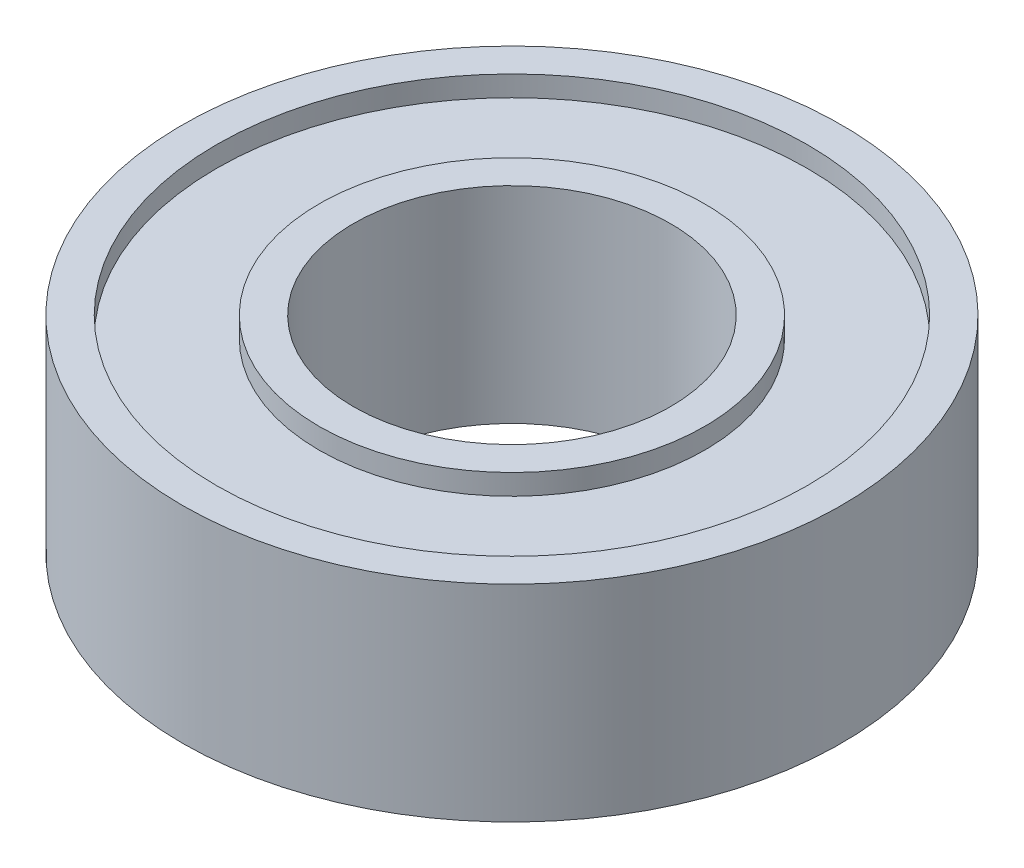
from build123d import *

# Parameters (mm, degrees)
SKETCH_1_R          = 8
SKETCH_1_R_2        = 3.85
EXTRUDE_1_DEPTH     = 2.5
SKETCH_2_R          = 7.17
SKETCH_2_R_2        = 4.68
CUT_EXTRUDE_1_DEPTH = 0.5


with BuildPart() as part:
    # Эскиз1 → Бобышка-Вытянуть1 (new, symmetric)
    with BuildSketch(Plane(origin=(0, 0, 0), x_dir=(1, 0, 0), z_dir=(0, 1, 0))):
        with Locations(Location((0, 0, 0), (0, 0, 270))):
            Circle(SKETCH_1_R)
        with Locations(Location((0, 0, 0), (0, 0, 270))):
            Circle(SKETCH_1_R_2, mode=Mode.SUBTRACT)
    extrude(amount=EXTRUDE_1_DEPTH, both=True)

    # Эскиз2 → Вырез-Вытянуть1 (cut)
    with BuildSketch(Plane(origin=(0, 2.5, 0), x_dir=(1, 0, 0), z_dir=(0, 1, 0))):
        with Locations(Location((0, 0, 0), (0, 0, 270))):
            Circle(SKETCH_2_R)
        with Locations(Location((0, 0, 0), (0, 0, 270))):
            Circle(SKETCH_2_R_2, mode=Mode.SUBTRACT)
    cut_extrude_1 = extrude(amount=-CUT_EXTRUDE_1_DEPTH, mode=Mode.SUBTRACT)

    # Зеркальное отражение1: Вырез-Вытянуть1 across plane
    add(cut_extrude_1.mirror(Plane.ZX), mode=Mode.SUBTRACT)


solid = part.part
